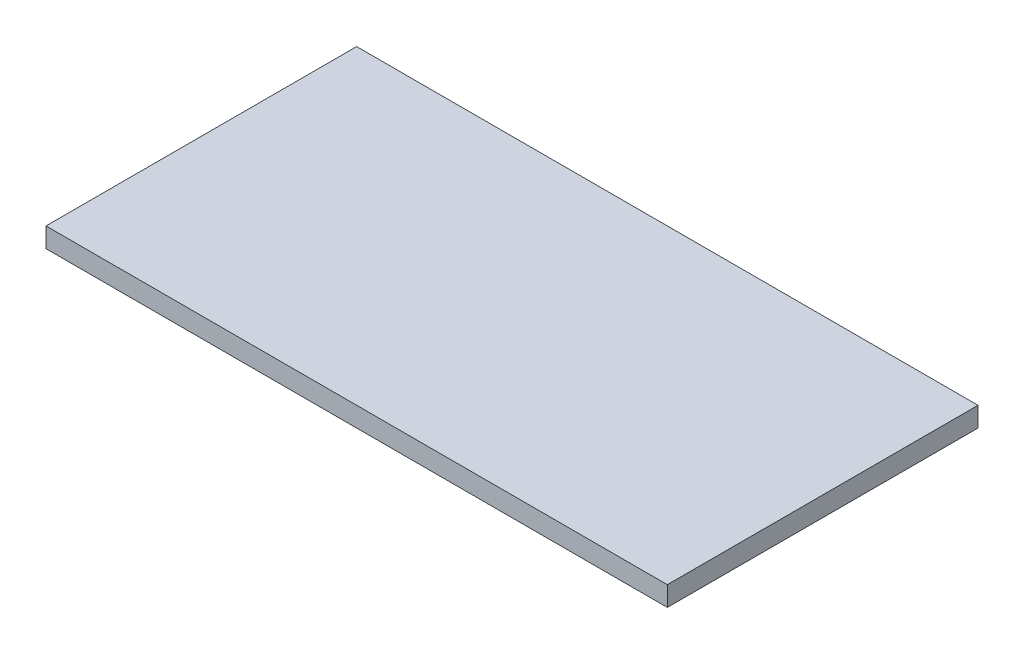
from build123d import *

# Parameters (mm, degrees)
SKETCH1_W           = 100
SKETCH1_H           = 50
BOSS_EXTRUDE1_DEPTH = 3.175


with BuildPart() as part:
    # Sketch1 → Boss-Extrude1 (new body)
    with BuildSketch(Plane(origin=(0, 0, 0), x_dir=(1, 0, 0), z_dir=(0, 1, 0))):
        Rectangle(SKETCH1_W, SKETCH1_H)
    extrude(amount=BOSS_EXTRUDE1_DEPTH)


solid = part.part
